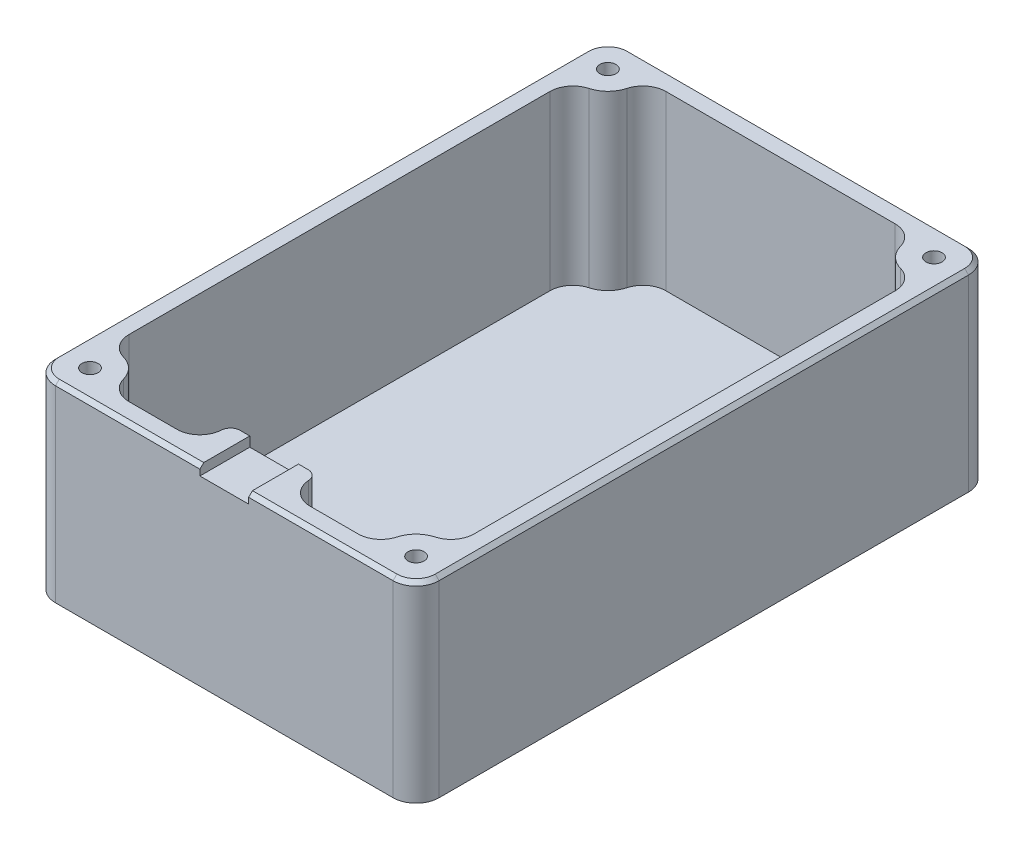
from build123d import *

# Parameters (mm, degrees)
SKETCH1_W                       = 100
SKETCH1_H                       = 150
BOSS_EXTRUDE1_DEPTH             = 25
TAP_DRILL_FOR_M5X0_8_TAP1_D     = 4.2
TAP_DRILL_FOR_M5X0_8_TAP1_DEPTH = 20
TAP_DRILL_FOR_M5X0_8_TAP1_TIP   = 1.2618073
CUT_EXTRUDE1_DEPTH              = 45
SKETCH6_W                       = 12.7
SKETCH6_H                       = 13
CUT_EXTRUDE2_DEPTH              = 2.54
FILLET1_R                       = 6
FILLET3_R                       = 2.5
CHAMFER1_SIZE                   = 1


with BuildPart() as part:
    # Sketch1 → Boss-Extrude1 (new, symmetric)
    with BuildSketch(Plane(origin=(0, 0, 0), x_dir=(1, 0, 0), z_dir=(0, 1, 0))):
        Rectangle(SKETCH1_W, SKETCH1_H)
    extrude(amount=BOSS_EXTRUDE1_DEPTH, both=True)

    # Tap Drill for M5x0.8 Tap1
    with Locations(Plane(origin=(-42.5, 25, -67.5), x_dir=(0, 0, 1), z_dir=(0, 1, 0))):
        with Locations((0, 0), (0, 85), (135, 85), (135, 0)):
            Hole(TAP_DRILL_FOR_M5X0_8_TAP1_D / 2, depth=TAP_DRILL_FOR_M5X0_8_TAP1_DEPTH)
            with Locations((0, 0, -(TAP_DRILL_FOR_M5X0_8_TAP1_DEPTH + TAP_DRILL_FOR_M5X0_8_TAP1_TIP / 2))):  # 118° drill point
                Cone(0, TAP_DRILL_FOR_M5X0_8_TAP1_D / 2, TAP_DRILL_FOR_M5X0_8_TAP1_TIP, mode=Mode.SUBTRACT)

    # Sketch5 → Cut-Extrude1 (cut)
    with BuildSketch(Plane(origin=(0, 25, 0), x_dir=(1, 0, 0), z_dir=(0, 1, 0))):
        with BuildLine():
            Line((-45, 60.85470091), (-45, -60.85470091))
            ThreePointArc((-45, -60.85470091), (-37.479541854, -62.479541854), (-35.85470091, -70))
            Line((-35.85470091, -70), (-11.35, -70))
            Line((-11.35, -70), (-11.35, -62))
            Line((-11.35, -62), (11.35, -62))
            Line((11.35, -62), (11.35, -70))
            Line((11.35, -70), (35.85470091, -70))
            ThreePointArc((35.85470091, -70), (37.479541854, -62.479541854), (45, -60.85470091))
            Line((45, -60.85470091), (45, 60.85470091))
            ThreePointArc((45, 60.85470091), (37.479541854, 62.479541854), (35.85470091, 70))
            Line((35.85470091, 70), (-35.85470091, 70))
            ThreePointArc((-35.85470091, 70), (-37.479541854, 62.479541854), (-45, 60.85470091))
        make_face()
    extrude(amount=-CUT_EXTRUDE1_DEPTH, mode=Mode.SUBTRACT)

    # Sketch6 → Cut-Extrude2 (cut)
    with BuildSketch(Plane(origin=(0, 25, 0), x_dir=(1, 0, 0), z_dir=(0, 1, 0))):
        with Locations((0, -68.5)):
            Rectangle(SKETCH6_W, SKETCH6_H)
    extrude(amount=-CUT_EXTRUDE2_DEPTH, mode=Mode.SUBTRACT)

    # Fillet1
    fillet1_edges = [part.edges().sort_by_distance(p)[0] for p in [
        (-45, 2.5, 60.85470091),
        (-35.85470091, 2.5, 70),
        (-11.35, 2.5, 70),
        (11.35, 2.5, 70),
        (35.85470091, 2.5, 70),
        (45, 2.5, 60.85470091),
        (45, 2.5, -60.85470091),
        (35.85470091, 2.5, -70),
        (-35.85470091, 2.5, -70),
        (-45, 2.5, -60.85470091),
        (50, 0, 75),
        (-50, 0, 75),
        (-50, 0, -75),
        (50, 0, -75),
    ]]
    fillet(fillet1_edges, radius=FILLET1_R)

    # Fillet3
    fillet3_edges = [part.edges().sort_by_distance(p)[0] for p in [
        (11.35, 2.5, 62),
        (-11.35, 2.5, 62),
    ]]
    fillet(fillet3_edges, radius=FILLET3_R)

    # Chamfer1
    chamfer1_edges = [part.edges().sort_by_distance(p)[0] for p in [
        (25.175, 25, 75),
        (0, 25, -75),
        (50, 25, 0),
        (-50, 25, 0),
        (-25.175, 25, 75),
        (48.242640687, 25, 73.242640687),
        (-48.242640687, 25, 73.242640687),
        (-48.242640687, 25, -73.242640687),
        (48.242640687, 25, -73.242640687),
    ]]
    chamfer(chamfer1_edges, length=CHAMFER1_SIZE)


solid = part.part
